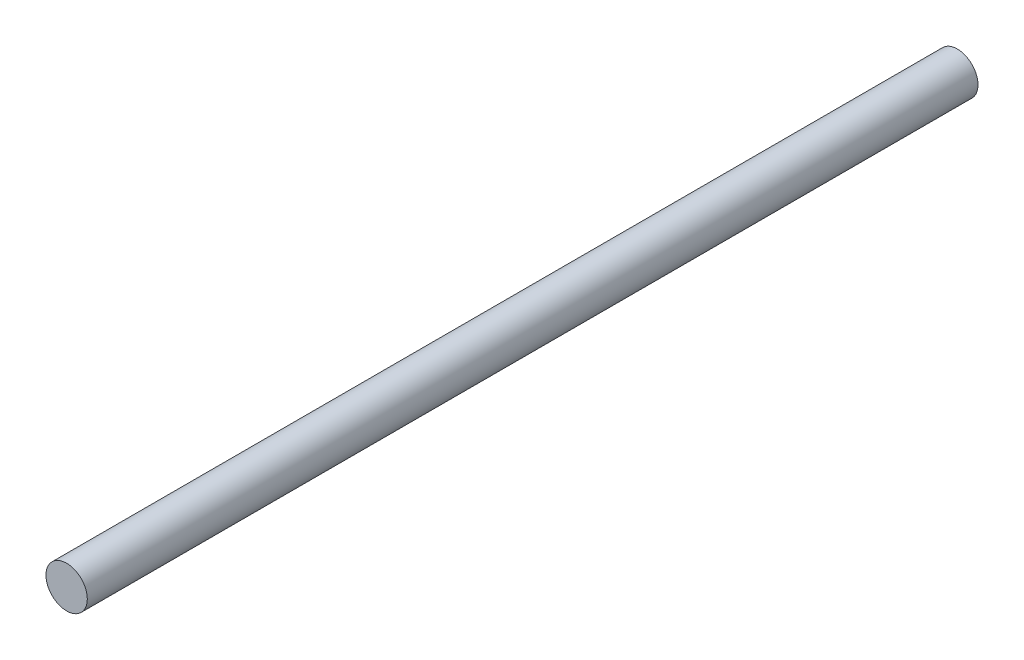
from build123d import *

# Parameters (mm, degrees)
SKETCH1_R           = 3.25
BOSS_EXTRUDE1_DEPTH = 140


with BuildPart() as part:
    # Sketch1 → Boss-Extrude1 (new body)
    with BuildSketch(Plane(origin=(0, 0, 0), x_dir=(0, 1, 0), z_dir=(0, 0, 1))):
        with Locations(Location((0, 0, 0), (0, 0, 270))):
            Circle(SKETCH1_R)
    extrude(amount=BOSS_EXTRUDE1_DEPTH)


solid = part.part
